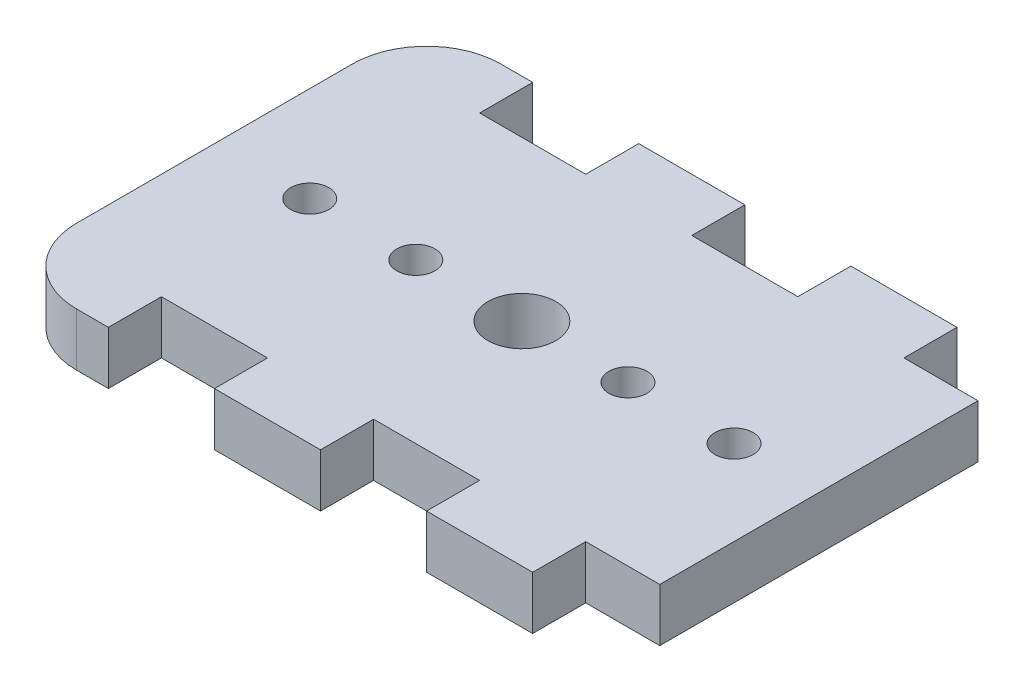
from build123d import *

# Parameters (mm, degrees)
MAIN_DEPTH             = 6.35
SKETCH3_R              = 4.064
SKETCH3_R_2            = 2.286
GEAR_MOUNT_HOLES_DEPTH = 51.497474194
SKETCH4_W              = 5.978415147
SKETCH4_H              = 38.1
SKETCH4_W_2            = 8.0137
CUT_EXTRUDE2_DEPTH     = 51.497474194
FILLET1_R              = 8.89


with BuildPart() as part:
    # Sketch1 → Main (new body)
    with BuildSketch(Plane(origin=(0, 0, 0), x_dir=(1, 0, 0), z_dir=(0, 1, 0))):
        Polygon((-43.18, 19.05), (-35.1663, 19.05), (-35.1663, 25.4), (-22.4663, 25.4), (-22.4663, 19.05), (-9.7663, 19.05), (-9.7663, 25.4), (2.9337, 25.4), (2.9337, 19.05), (15.6337, 19.05), (15.6337, 25.4), (28.3337, 25.4), (28.3337, 19.05), (43.18, 19.05), (43.18, -19.05), (28.3337, -19.05), (28.3337, -25.4), (15.6337, -25.4), (15.6337, -19.05), (2.9337, -19.05), (2.9337, -25.4), (-9.7663, -25.4), (-9.7663, -19.05), (-22.4663, -19.05), (-22.4663, -25.4), (-35.1663, -25.4), (-35.1663, -19.05), (-43.18, -19.05), align=None)
    extrude(amount=MAIN_DEPTH)

    # Sketch3 → Gear Mount Holes (cut, through all)
    with BuildSketch(Plane(origin=(0, 6.35, 0), x_dir=(1, 0, 0), z_dir=(0, 1, 0))):
        with Locations(Location((1.641584853, 0, 0), (0, 0, 270))):
            Circle(SKETCH3_R)
        with Locations(Location((14.341584853, 0, 0), (0, 0, 270))):
            Circle(SKETCH3_R_2)
        with Locations(Location((27.041584853, 0, 0), (0, 0, 270))):
            Circle(SKETCH3_R_2)
        with Locations(Location((-11.058415147, 0, 0), (0, 0, 270))):
            Circle(SKETCH3_R_2)
        with Locations(Location((-23.758415147, 0, 0), (0, 0, 270))):
            Circle(SKETCH3_R_2)
    extrude(amount=-GEAR_MOUNT_HOLES_DEPTH, mode=Mode.SUBTRACT)

    # Sketch4 → Cut-Extrude2 (cut, through all)
    with BuildSketch(Plane(origin=(0, 6.35, 0), x_dir=(1, 0, 0), z_dir=(0, 1, 0))):
        with Locations((40.190792426, 0)):
            Rectangle(SKETCH4_W, SKETCH4_H)
        with Locations((-39.17315, 0)):
            Rectangle(SKETCH4_W_2, SKETCH4_H)
    extrude(amount=-CUT_EXTRUDE2_DEPTH, mode=Mode.SUBTRACT)

    # Fillet1
    fillet1_edges = [part.edges().sort_by_distance(p)[0] for p in [
        (-35.1663, 3.175, -25.4),
        (-35.1663, 3.175, 25.4),
    ]]
    fillet(fillet1_edges, radius=FILLET1_R)


solid = part.part
